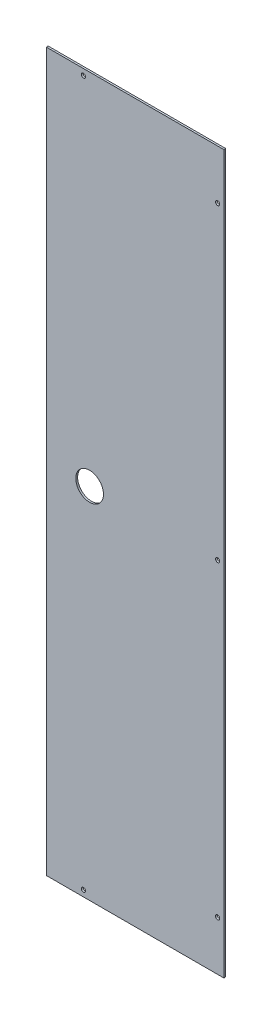
from build123d import *

# Parameters (mm, degrees)
MAIN_PROFILE_SKETCH_W   = 143.5
MAIN_PROFILE_SKETCH_H   = 580
MAIN_PROFILE_SKETCH_R   = 1.7
MAIN_PROFILE_SKETCH_R_2 = 11.2
MAIN_EXTRUSION_DEPTH    = 1.5


with BuildPart() as part:
    # Main Profile Sketch → Main Extrusion (new body)
    with BuildSketch(Plane.XY.offset(111.5)):
        with Locations((-213.25, 0)):
            Rectangle(MAIN_PROFILE_SKETCH_W, MAIN_PROFILE_SKETCH_H)
        with Locations((-255, -285)):
            Circle(MAIN_PROFILE_SKETCH_R, mode=Mode.SUBTRACT)
        with Locations((-146.5, -250)):
            Circle(MAIN_PROFILE_SKETCH_R, mode=Mode.SUBTRACT)
        with Locations((-250, 0)):
            Circle(MAIN_PROFILE_SKETCH_R_2, mode=Mode.SUBTRACT)
        with Locations((-255, 285)):
            Circle(MAIN_PROFILE_SKETCH_R, mode=Mode.SUBTRACT)
        with Locations((-146.5, 0)):
            Circle(MAIN_PROFILE_SKETCH_R, mode=Mode.SUBTRACT)
        with Locations((-146.5, 250)):
            Circle(MAIN_PROFILE_SKETCH_R, mode=Mode.SUBTRACT)
    extrude(amount=-MAIN_EXTRUSION_DEPTH)


solid = part.part
